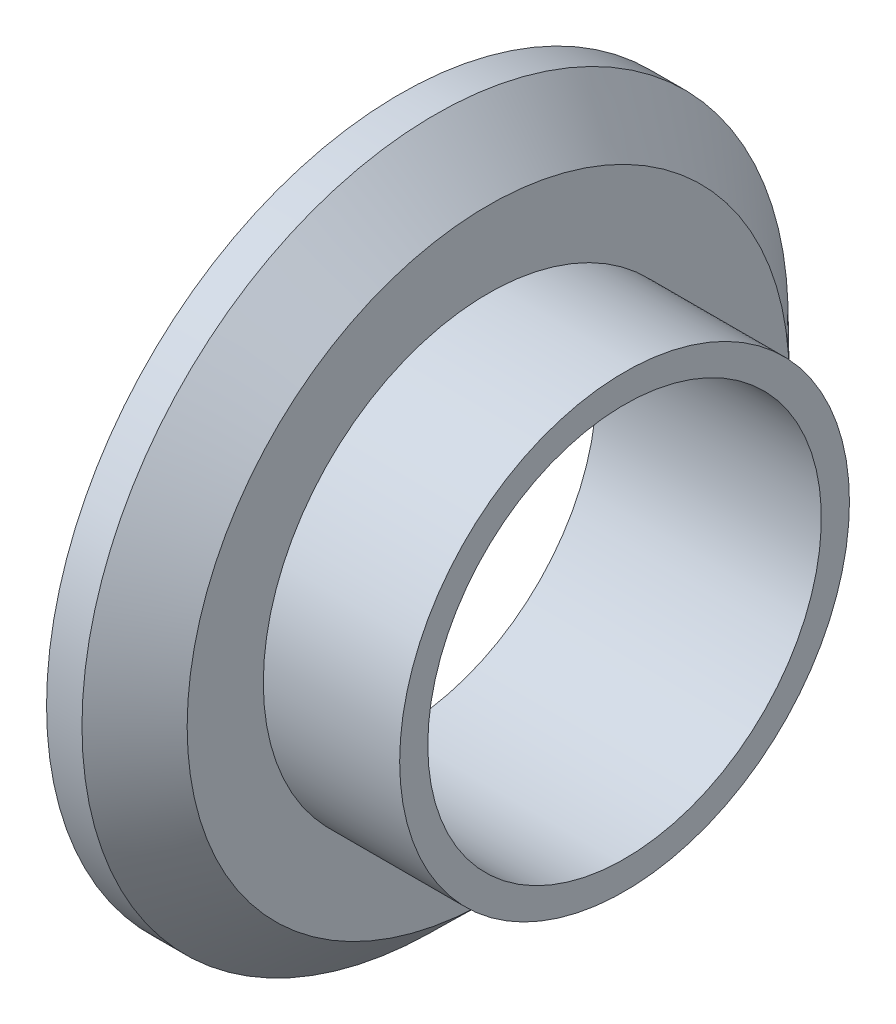
from build123d import *


with BuildPart() as part:
    # Axial profile (mm) → Full revolution (revolve)
    with BuildSketch(Plane.XY, mode=Mode.PRIVATE) as full_revolution_sk:
        Polygon((1, 11.1125), (13.7, 11.1125), (13.7, 12.7), (6, 12.7), (6, 17), (3, 19.94), (1, 19.94), align=None)
    revolve(full_revolution_sk.sketch.rotate(Axis((-110, 0, 0), (1, 0, 0)), 90), axis=Axis((-110, 0, 0), (1, 0, 0)))


solid = part.part
